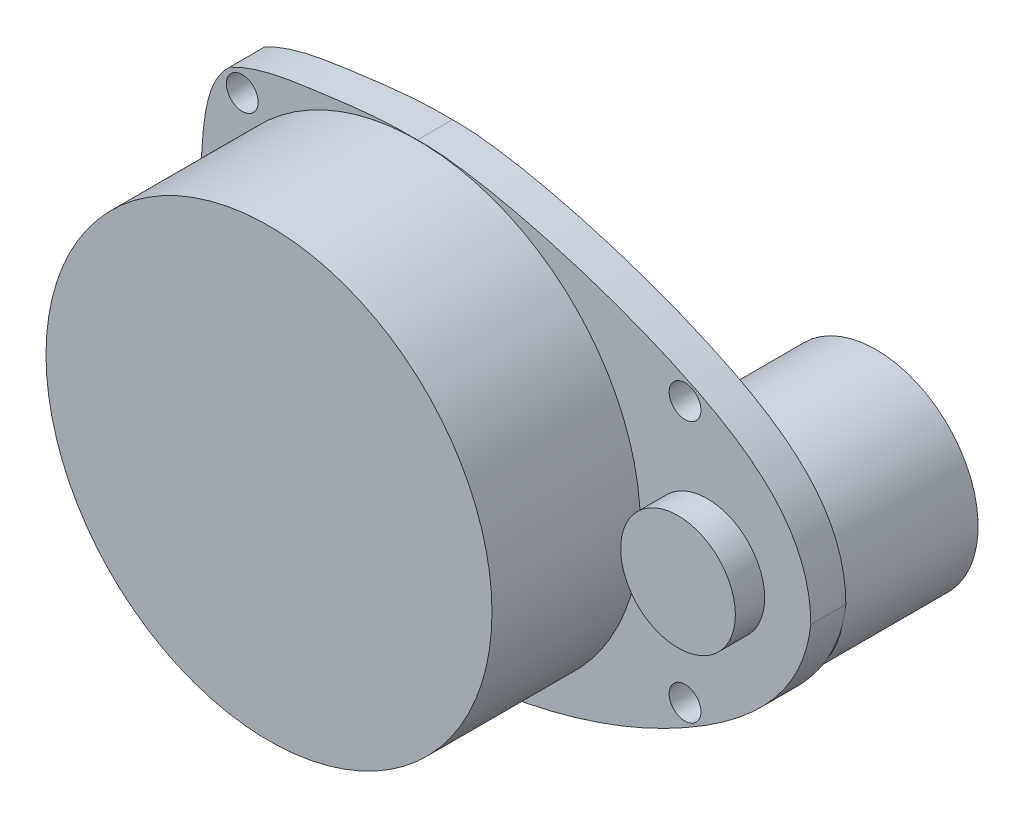
from build123d import *

# Parameters (mm, degrees)
BOSS_EXTRU_1_DEPTH      = 5.5
ESQUISSE3_R             = 2.5
ENL_V_MAT_EXTRU_1_DEPTH = 5.5
ESQUISSE4_R             = 9
BOSS_EXTRU_3_DEPTH      = 4.6
ESQUISSE2_R             = 35
BOSS_EXTRU_2_DEPTH      = 23.3
ESQUISSE5_R             = 16
BOSS_EXTRU_4_DEPTH      = 21


with BuildPart() as part:
    # Esquisse1 → Boss.-Extru.1 (new body)
    with BuildSketch(Plane.XY):
        with BuildLine():
            add(Edge.make_bspline(
                [(96.74, 35.14), (96.700966604, 46.914828886), (76.669243873, 62.532909125), (43.186721807, 70.453815297), (35, 70.14)],
                knots=[0, 0, 0, 0, 0.420118968, 1, 1, 1, 1], degree=3))
            add(Edge.make_bspline(
                [(35, 70.14), (29.89922146, 70.296066514), (19.629650744, 68.989823621), (9.641451794, 67.514202382), (5.51358225, 65.29011499)],
                knots=[0, 0, 0, 0, 0.536066819, 1, 1, 1, 1], degree=3))
            add(Edge.make_bspline(
                [(5.51358225, 65.29011499), (1.61130463, 61.662907457), (1.250702971, 49.999272028), (-0.535437112, 34.426866806), (0.654932347, 19.165653112), (2.922501297, 9.271234675), (5.092204, 5.66435325)],
                knots=[0, 0, 0, 0, 0.25720549, 0.505904817, 0.797009019, 1, 1, 1, 1], degree=3))
            add(Edge.make_bspline(
                [(96.74, 35.14), (95.57744451, 24.437841166), (74.678338114, 6.386866594), (40.041164519, -1.581693557), (14.123677955, 0.659923037), (5.092204, 5.66435325)],
                knots=[0, 0, 0, 0, 0.293375681, 0.712147859, 1, 1, 1, 1], degree=3))
        make_face()
    extrude(amount=BOSS_EXTRU_1_DEPTH)

    # Esquisse3 → Enlèv. mat.-Extru.1 (cut)
    with BuildSketch(Plane.XY.offset(5.5)):
        with Locations((7.5, 62.78)):
            Circle(ESQUISSE3_R)
        with Locations((7.5, 7.5)):
            Circle(ESQUISSE3_R)
        with Locations((77, 14.64)):
            Circle(ESQUISSE3_R)
        with Locations((77, 55.64)):
            Circle(ESQUISSE3_R)
    extrude(amount=-ENL_V_MAT_EXTRU_1_DEPTH, mode=Mode.SUBTRACT)

    # Esquisse4 → Boss.-Extru.3 (add)
    with BuildSketch(Plane.XY.offset(5.5)):
        with Locations((80.5, 35.14)):
            Circle(ESQUISSE4_R)
    extrude(amount=BOSS_EXTRU_3_DEPTH)

    # Esquisse2 → Boss.-Extru.2 (add)
    with BuildSketch(Plane.XY.offset(5.5)):
        with Locations(Location((35, 35.113142172, 0), (0, 0, 179.955291193))):
            Circle(ESQUISSE2_R)
    extrude(amount=BOSS_EXTRU_2_DEPTH)

    # Esquisse5 → Boss.-Extru.4 (add)
    with BuildSketch(Plane(origin=(0, 0, 0), x_dir=(-1, 0, 0), z_dir=(0, 0, -1))):
        with Locations(Location((-80.5, 35.14, 0), (0, 0, 190.060871127))):
            Circle(ESQUISSE5_R)
    extrude(amount=BOSS_EXTRU_4_DEPTH)


solid = part.part
